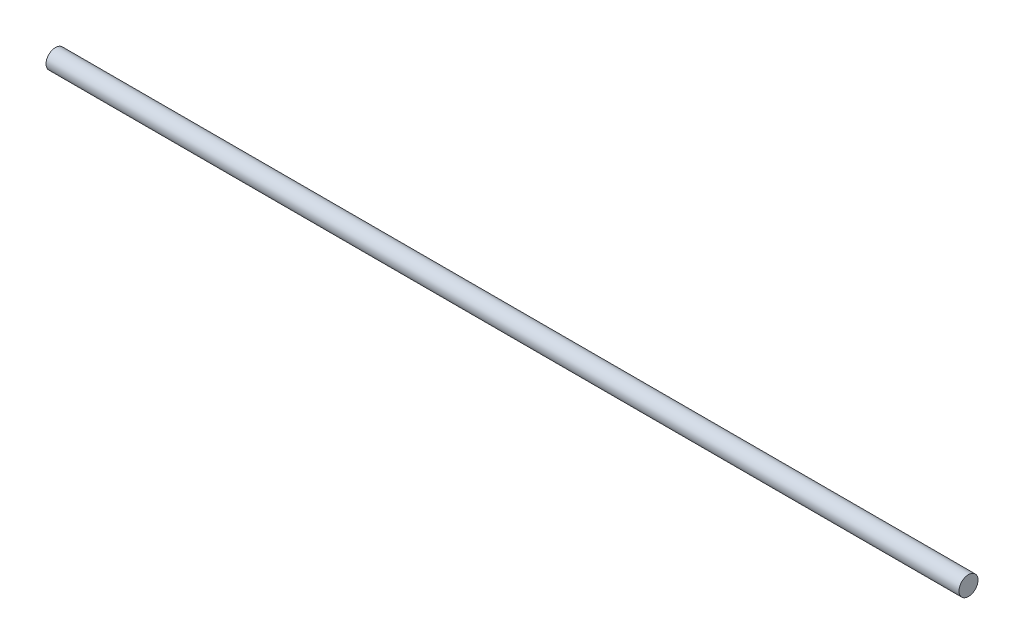
from build123d import *

# Parameters (mm, degrees)
SKETCH1_R           = 6.35
BOSS_EXTRUDE1_DEPTH = 304.8


with BuildPart() as part:
    # Sketch1 → Boss-Extrude1 (new, symmetric)
    with BuildSketch(Plane(origin=(0, 0, 0), x_dir=(0, 0, -1), z_dir=(1, 0, 0))):
        with Locations(Location((0, 0, 0), (0, 0, 180))):
            Circle(SKETCH1_R)
    extrude(amount=BOSS_EXTRUDE1_DEPTH, both=True)


solid = part.part
